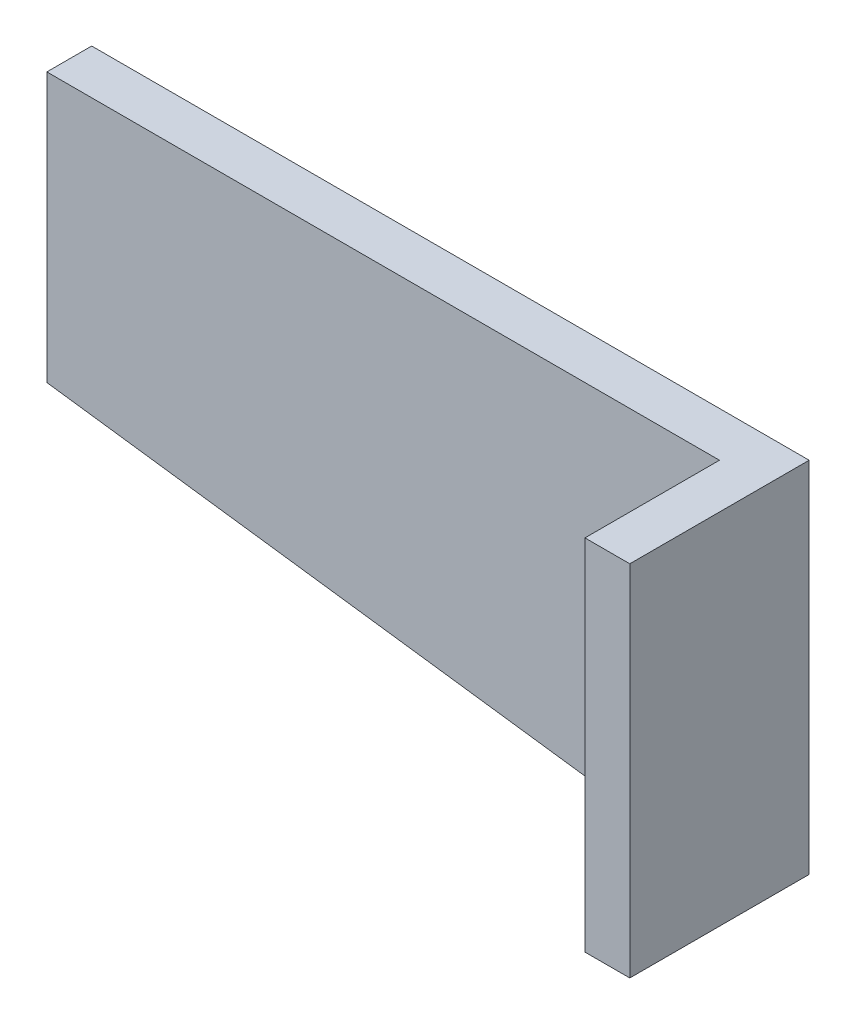
from build123d import *

# Parameters (mm, degrees)
BOSS_EXTRUDE1_DEPTH = 3.175
SKETCH2_3_W         = 3.175
SKETCH2_3_H         = 25.4
BOSS_EXTRUDE2_DEPTH = 12.7


with BuildPart() as part:
    # Sketch2 → Boss-Extrude1 (new body)
    with BuildSketch(Plane.XY):
        Polygon((0, 0), (0, -19.05), (47.625, -25.4), (50.8, -25.4), (50.8, 0), align=None)
    extrude(amount=BOSS_EXTRUDE1_DEPTH)

    # Sketch2<3> → Boss-Extrude2 (add)
    with BuildSketch(Plane.XY):
        with Locations((49.2125, -12.7)):
            Rectangle(SKETCH2_3_W, SKETCH2_3_H)
    extrude(amount=BOSS_EXTRUDE2_DEPTH)


solid = part.part
